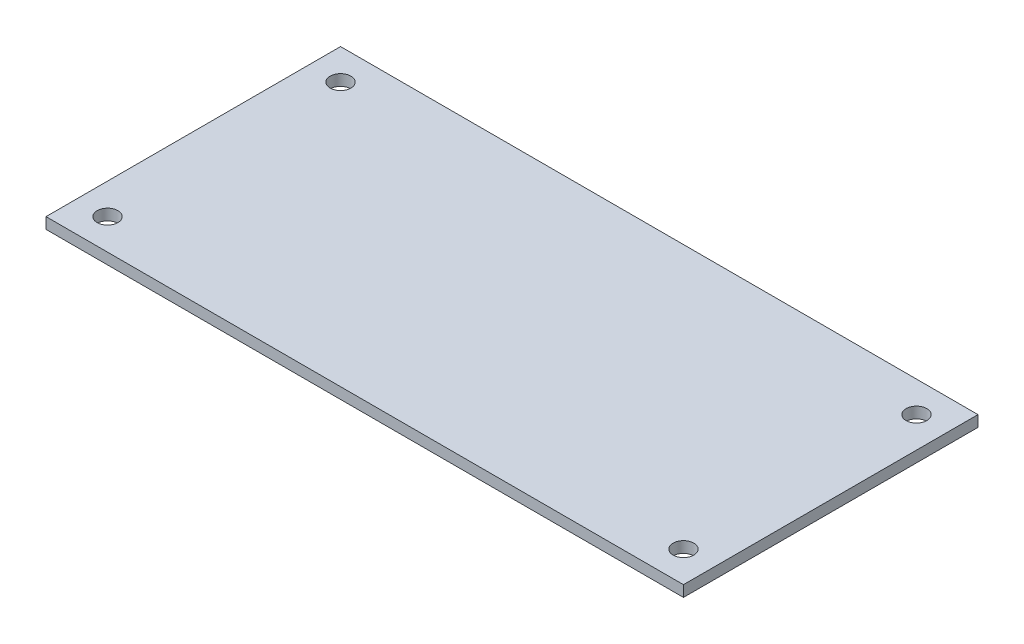
from build123d import *

# Parameters (mm, degrees)
SKETCH2_W             = 92.075
SKETCH2_H             = 42.545
PCBBASE_DEPTH         = 1.6
F_3_0MM_DOWEL_HOLE2_D = 3


with BuildPart() as part:
    # Sketch2 → PCBBase (new body)
    with BuildSketch(Plane(origin=(0, 0, 0), x_dir=(1, 0, 0), z_dir=(0, 1, 0))):
        Rectangle(SKETCH2_W, SKETCH2_H)
    extrude(amount=PCBBASE_DEPTH)

    # Ø3.0mm Dowel Hole2 (through all)
    with Locations(Plane.XZ):
        with Locations((-41.5925, -16.8275), (-41.5925, 16.8275), (41.5925, 16.8275), (41.5925, -16.8275)):
            Hole(F_3_0MM_DOWEL_HOLE2_D / 2)


solid = part.part
